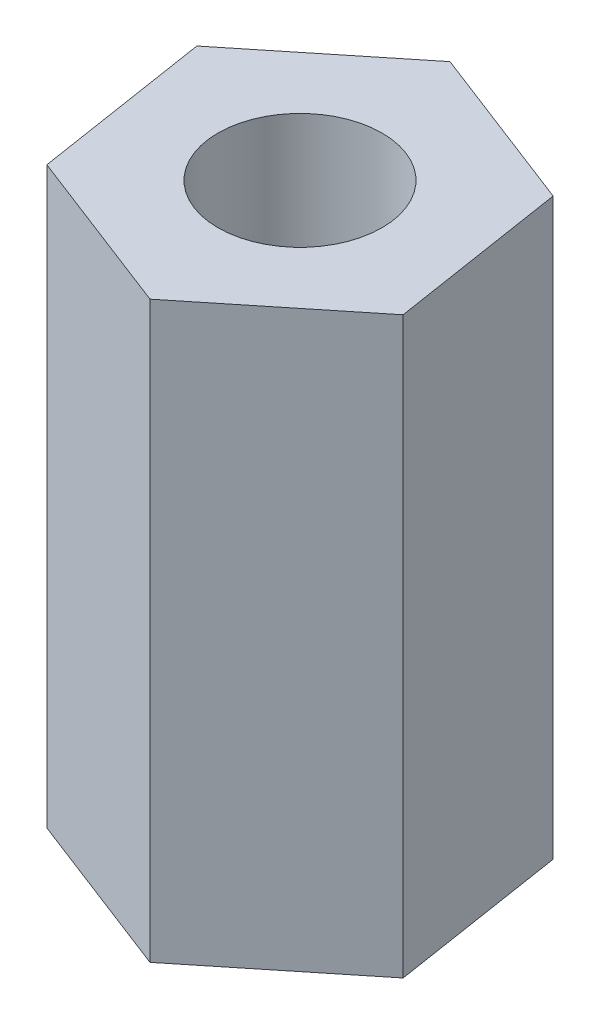
from build123d import *

# Parameters (mm, degrees)
SZKIC1_R                    = 5
DODANIE_WYCI_GNI_CIE1_DEPTH = 35


with BuildPart() as part:
    # Szkic1 → Dodanie-wyciągnięcie1 (new body)
    with BuildSketch(Plane(origin=(0, 0, 0), x_dir=(1, 0, 0), z_dir=(0, 1, 0))):
        Polygon((-10.233844985, 3.949905082), (-8.537640636, -6.887817194), (1.696204349, -10.837722276), (10.233844985, -3.949905082), (8.537640636, 6.887817194), (-1.696204349, 10.837722276), align=None)
        with Locations(Location((0, 0, 0), (0, 0, 270))):
            Circle(SZKIC1_R, mode=Mode.SUBTRACT)
    extrude(amount=DODANIE_WYCI_GNI_CIE1_DEPTH)


solid = part.part
